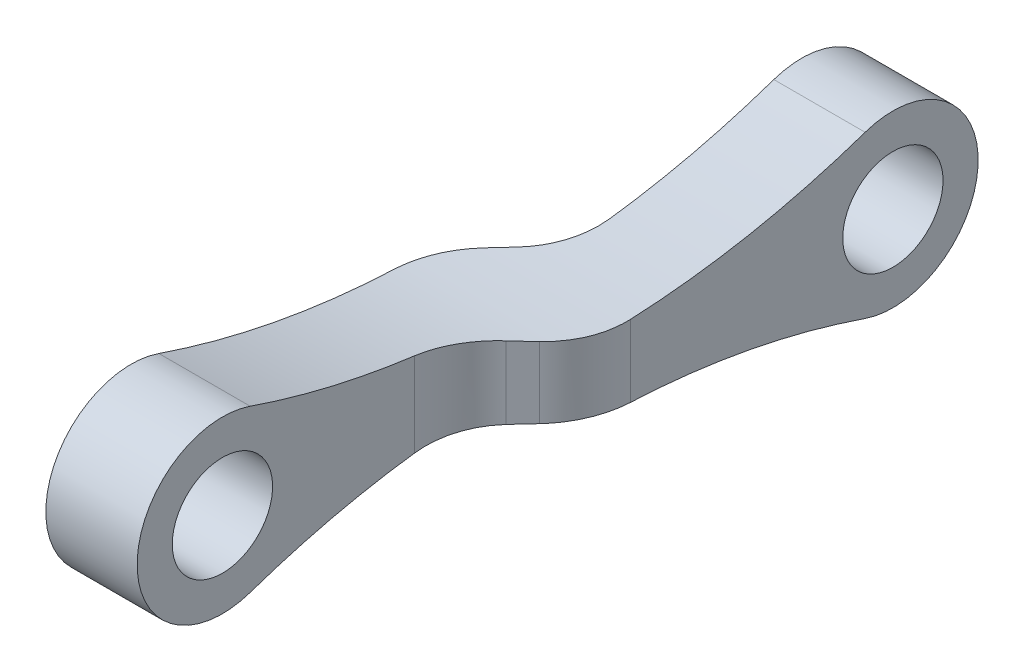
from build123d import *

# Parameters (mm, degrees)
SKETCH1_R               = 3.57
BOSS_EXTRUDE1_DEPTH     = 11.5
CUT_EXTRUDE2_DEPTH      = 51.493157952
CUT_EXTRUDE2_DEPTH_BACK = 51.493157952
FILLET1_R               = 6.5


with BuildPart() as part:
    # Sketch1 → Boss-Extrude1 (new body)
    with BuildSketch(Plane(origin=(0, 0, 0), x_dir=(0, 0, -1), z_dir=(1, 0, 0))):
        with BuildLine():
            ThreePointArc((-1.973878431, -5.740096161), (6.07, 0), (-1.973878431, 5.740096161))
            ThreePointArc((-1.973878431, 5.740096161), (-21.36, 2.5), (-40.746121569, 5.740096161))
            ThreePointArc((-40.746121569, 5.740096161), (-48.79, 0), (-40.746121569, -5.740096161))
            ThreePointArc((-40.746121569, -5.740096161), (-21.36, -2.5), (-1.973878431, -5.740096161))
        make_face()
        Circle(SKETCH1_R, mode=Mode.SUBTRACT)
        with Locations((-42.72, 0)):
            Circle(SKETCH1_R, mode=Mode.SUBTRACT)
    extrude(amount=BOSS_EXTRUDE1_DEPTH)

    # Sketch2 → Cut-Extrude2 (cut, two sides: drawn at the far end of the back side and taken through both)
    with BuildSketch(Plane(origin=(0, 0, 0), x_dir=(1, 0, 0), z_dir=(0, 1, 0)).offset(-CUT_EXTRUDE2_DEPTH_BACK)):
        Polygon((11.5, -48.79), (6.5, -48.79), (6.5, -26.36), (11.5, -21.36), align=None)
        Polygon((5, -16.30090598), (5, 6.07), (0, 6.07), (0, -21.30090598), align=None)
    extrude(amount=CUT_EXTRUDE2_DEPTH + CUT_EXTRUDE2_DEPTH_BACK, mode=Mode.SUBTRACT)

    # Fillet1
    fillet1_edges = [part.edges().sort_by_distance(p)[0] for p in [
        (0, 0, 21.30090598),
        (5, 0, 16.30090598),
        (6.5, 0, 26.36),
        (11.5, 0, 21.36),
    ]]
    fillet(fillet1_edges, radius=FILLET1_R)


solid = part.part
